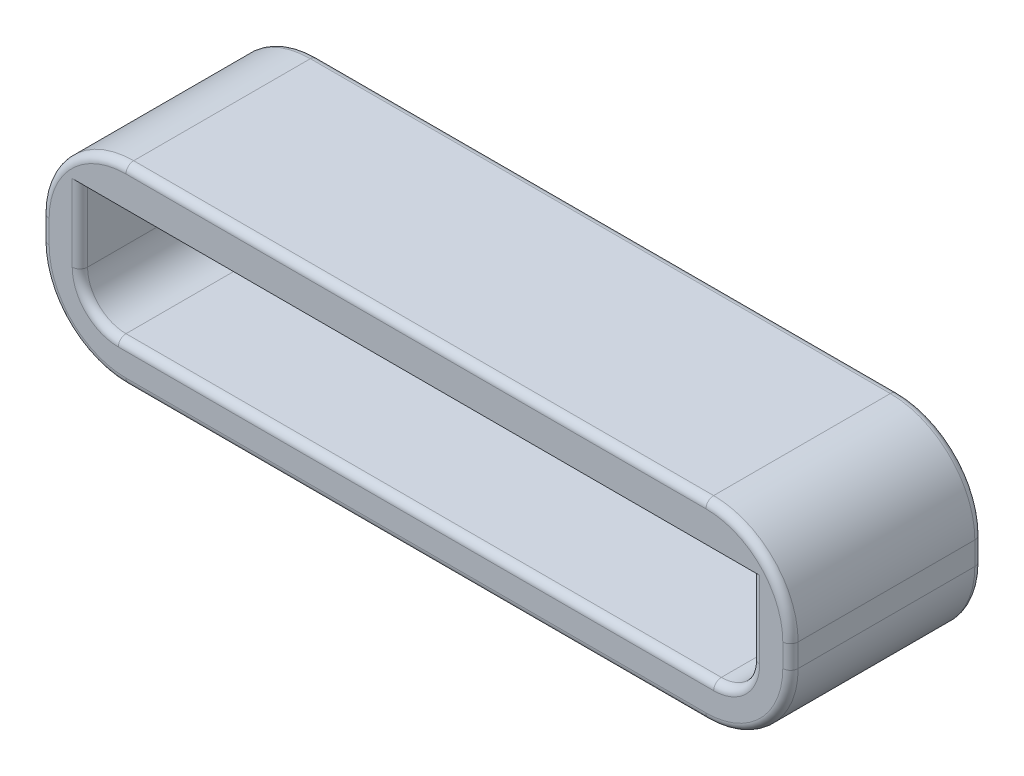
from build123d import *

# Parameters (mm, degrees)
SKETCH_1_W      = 19.5
SKETCH_1_H      = 5
SKETCH_1_W_2    = 17.5
SKETCH_1_H_2    = 3
EXTRUDE_1_DEPTH = 5
FILLET_1_R      = 2.2
FILLET_2_R      = 1
FILLET_3_R      = 0.2


with BuildPart() as part:
    # Эскиз1 → Бобышка-Вытянуть1 (new body)
    with BuildSketch(Plane.XY):
        Rectangle(SKETCH_1_W, SKETCH_1_H)
        Rectangle(SKETCH_1_W_2, SKETCH_1_H_2, mode=Mode.SUBTRACT)
    extrude(amount=EXTRUDE_1_DEPTH)

    # Скругление1
    fillet_1_edges = [part.edges().sort_by_distance(p)[0] for p in [
        (-9.75, 2.5, 2.5),
        (9.75, 2.5, 2.5),
        (9.75, -2.5, 2.5),
        (-9.75, -2.5, 2.5),
    ]]
    fillet(fillet_1_edges, radius=FILLET_1_R)

    # Скругление2
    fillet_2_edges = [part.edges().sort_by_distance(p)[0] for p in [
        (8.75, -1.5, 2.5),
        (-8.75, -1.5, 2.5),
    ]]
    fillet(fillet_2_edges, radius=FILLET_2_R)

    # Скругление3
    fillet_3_edges = [part.edges().sort_by_distance(p)[0] for p in [
        (-8.75, 0.5, 0),
        (-8.75, 0.5, 5),
        (0, 2.5, 0),
        (0, 2.5, 5),
        (-9.75, 0, 0),
        (9.75, 0, 0),
        (0, -2.5, 0),
        (9.105634919, -1.855634919, 0),
        (-9.105634919, -1.855634919, 0),
        (-9.105634919, 1.855634919, 0),
        (9.105634919, 1.855634919, 0),
        (9.75, 0, 5),
        (-9.75, 0, 5),
        (0, -2.5, 5),
        (9.105634919, -1.855634919, 5),
        (-9.105634919, -1.855634919, 5),
        (-9.105634919, 1.855634919, 5),
        (9.105634919, 1.855634919, 5),
        (0, -1.5, 0),
        (0, -1.5, 5),
        (8.75, 0.5, 0),
        (8.75, 0.5, 5),
        (-8.457106781, -1.207106781, 0),
        (-8.457106781, -1.207106781, 5),
        (8.457106781, -1.207106781, 0),
        (8.457106781, -1.207106781, 5),
    ]]
    fillet(fillet_3_edges, radius=FILLET_3_R)


solid = part.part
